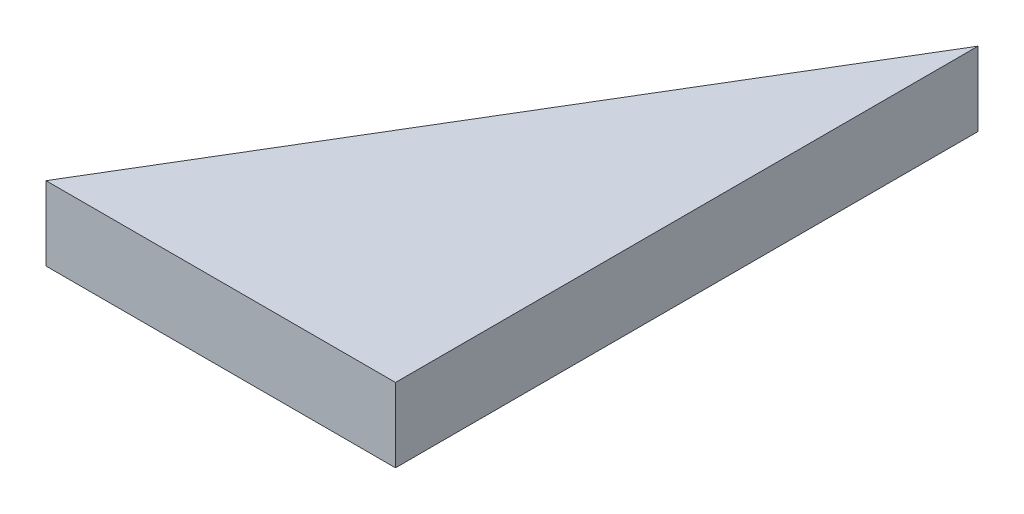
from build123d import *

# Parameters (mm, degrees)
BOSS_EXTRU_1_DEPTH = 6.35


with BuildPart() as part:
    # Esquisse1 → Boss.-Extru.1 (new body)
    with BuildSketch(Plane(origin=(0, 0, 0), x_dir=(1, 0, 0), z_dir=(0, 1, 0))):
        Polygon((-30, 0), (0, 0), (0, 50), align=None)
    extrude(amount=BOSS_EXTRU_1_DEPTH)


solid = part.part
